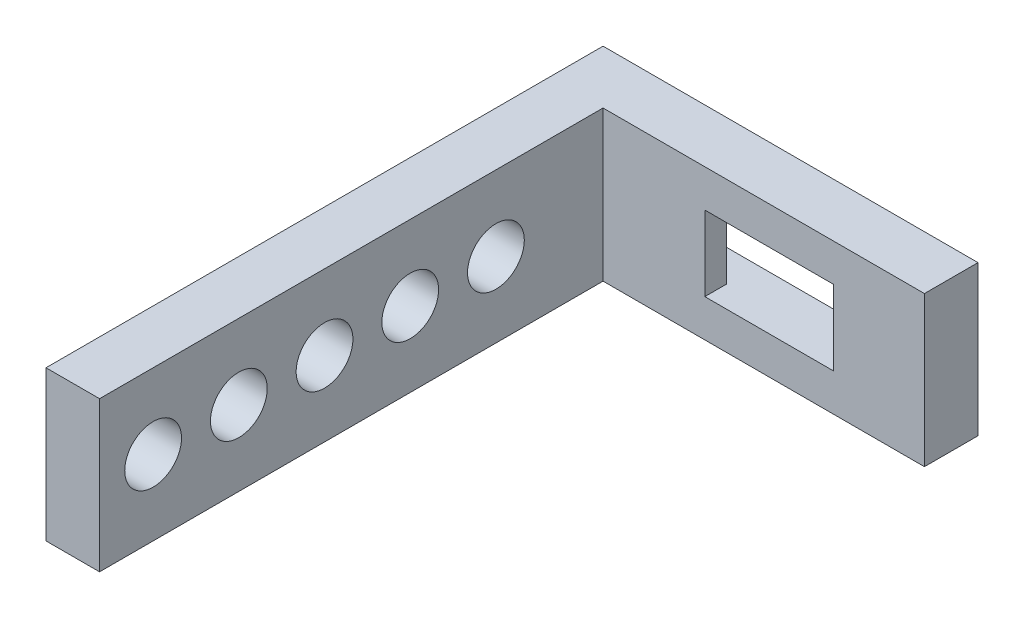
from build123d import *

# Parameters (mm, degrees)
BOSS_EXTRUDE1_DEPTH  = 14
SKETCH20_W           = 43
SKETCH20_H           = 14
BOSS_EXTRUDE10_DEPTH = 5
SKETCH21_R           = 2.65
CUT_EXTRUDE13_DEPTH  = 5
SKETCH22_W           = 5
SKETCH22_H           = 4
CUT_EXTRUDE14_DEPTH  = 61.373835392
SKETCH23_R           = 2.65
BOSS_EXTRUDE11_DEPTH = 5
SKETCH24_W           = 25
SKETCH24_H           = 7
CUT_EXTRUDE15_DEPTH  = 3
CUT_EXTRUDE16_REACH  = 66.784
SKETCH25_W           = 12
SKETCH25_H           = 7
CUT_EXTRUDE17_REACH  = 69.082
SKETCH26_W           = 5
SKETCH26_H           = 14


with BuildPart() as part:
    # Sketch1 → Boss-Extrude1 (new body)
    with BuildSketch(Plane(origin=(0, 0, 0), x_dir=(1, 0, 0), z_dir=(0, 1, 0))):
        Polygon((6.589095597, 0), (10, 0), (10, 4), (40, 4), (40, 9), (11.589095597, 9), (0, 9), (0, 0), align=None)
    extrude(amount=BOSS_EXTRUDE1_DEPTH)

    # Sketch20 → Boss-Extrude10 (add)
    with BuildSketch(Plane.ZY):
        with Locations((21.5, 7)):
            Rectangle(SKETCH20_W, SKETCH20_H)
    extrude(amount=-BOSS_EXTRUDE10_DEPTH)

    # Sketch21 → Cut-Extrude13 (cut)
    with BuildSketch(Plane.ZY):
        with Locations((-2, 7)):
            Circle(SKETCH21_R)
        with Locations((6, 7)):
            Circle(SKETCH21_R)
        with Locations((14, 7)):
            Circle(SKETCH21_R)
        with Locations((22, 7)):
            Circle(SKETCH21_R)
        with Locations((30, 7)):
            Circle(SKETCH21_R)
        with Locations((38, 7)):
            Circle(SKETCH21_R)
    extrude(amount=-CUT_EXTRUDE13_DEPTH, mode=Mode.SUBTRACT)

    # Sketch22 → Cut-Extrude14 (cut, through all)
    with BuildSketch(Plane(origin=(0, 14, 0), x_dir=(1, 0, 0), z_dir=(0, 1, 0))):
        with Locations((7.5, 2)):
            Rectangle(SKETCH22_W, SKETCH22_H)
    extrude(amount=-CUT_EXTRUDE14_DEPTH, mode=Mode.SUBTRACT)

    # Sketch23 → Boss-Extrude11 (add)
    with BuildSketch(Plane.ZY):
        with Locations((-2, 7)):
            Circle(SKETCH23_R)
    extrude(amount=-BOSS_EXTRUDE11_DEPTH)

    # Sketch24 → Cut-Extrude15 (cut)
    with BuildSketch(Plane(origin=(0, 0, -9), x_dir=(-1, 0, 0), z_dir=(0, 0, -1))):
        with Locations((-20.5, 7)):
            Rectangle(SKETCH24_W, SKETCH24_H)
    extrude(amount=-CUT_EXTRUDE15_DEPTH, mode=Mode.SUBTRACT)

    # Sketch25 → Cut-Extrude16 (cut, up to next)
    with BuildSketch(Plane(origin=(0, 0, -6), x_dir=(-1, 0, 0), z_dir=(0, 0, -1)), mode=Mode.PRIVATE) as cut_extrude16_sk1:
        with Locations((-20.5, 7)):
            Rectangle(SKETCH25_W, SKETCH25_H)
    cut_extrude16_tool1 = extrude(cut_extrude16_sk1.sketch, amount=-CUT_EXTRUDE16_REACH, mode=Mode.PRIVATE) & part.part
    add(cut_extrude16_tool1.solids().sort_by_distance((20.5, 7, -6))[0], mode=Mode.SUBTRACT)

    # Sketch26 → Cut-Extrude17 (cut, up to next)
    with BuildSketch(Plane(origin=(0, 0, -9), x_dir=(-1, 0, 0), z_dir=(0, 0, -1)), mode=Mode.PRIVATE) as cut_extrude17_sk1:
        with Locations((-37.5, 7)):
            Rectangle(SKETCH26_W, SKETCH26_H)
    cut_extrude17_tool1 = extrude(cut_extrude17_sk1.sketch, amount=-CUT_EXTRUDE17_REACH, mode=Mode.PRIVATE) & part.part
    add(cut_extrude17_tool1.solids().sort_by_distance((37.5, 7, -9))[0], mode=Mode.SUBTRACT)


solid = part.part
